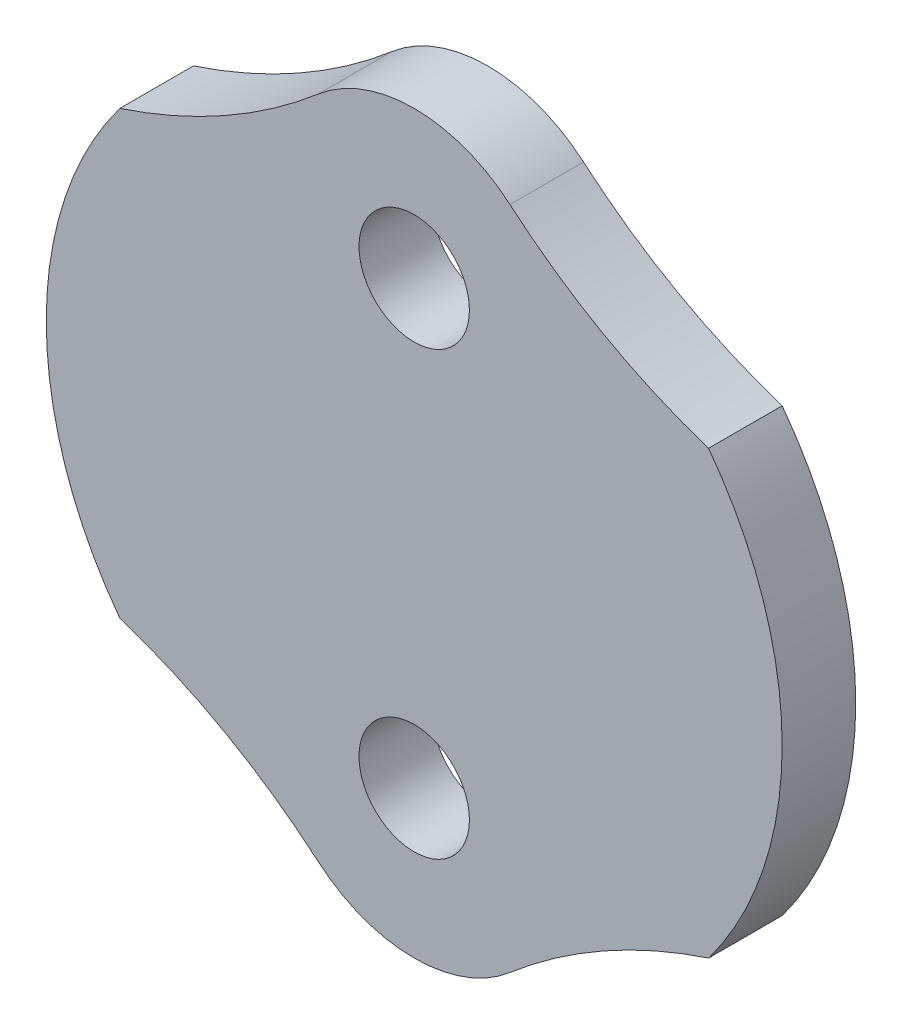
from build123d import *

# Parameters (mm, degrees)
SKETCH1_R           = 15.875
SKETCH1_R_2         = 2.38125
BOSS_EXTRUDE2_DEPTH = 3.175
SKETCH2_R           = 26.68586127
SKETCH2_R_2         = 15.875
CUT_EXTRUDE1_DEPTH  = 31.120694713


with BuildPart() as part:
    # Sketch1 → Boss-Extrude2 (new body)
    with BuildSketch(Plane.XY):
        with Locations((0, 9.525)):
            Circle(SKETCH1_R)
        Circle(SKETCH1_R_2, mode=Mode.SUBTRACT)
        with Locations((0, 19.05)):
            Circle(SKETCH1_R_2, mode=Mode.SUBTRACT)
    extrude(amount=BOSS_EXTRUDE2_DEPTH)

    # Sketch2 → Cut-Extrude1 (cut, through all)
    # profile 1 of 5: a face of its own
    with BuildSketch(Plane.XY.offset(3.175)):
        with Locations((0, 9.525)):
            Circle(SKETCH2_R)
        with Locations((0, 9.525)):
            Circle(SKETCH2_R_2, mode=Mode.SUBTRACT)
    # profile 2 of 5: a face of its own
    with BuildSketch(Plane.XY.offset(3.175)):
        with BuildLine():
            ThreePointArc((-4.130251428, 23.873227461), (-2.201704524, 25.006089085), (0, 25.4))
            ThreePointArc((0, 25.4), (-7.099515829, 23.724031657), (-12.7, 19.05))
            ThreePointArc((-12.7, 19.05), (-8.178609866, 21.041380315), (-4.130251428, 23.873227461))
        make_face()
    # profile 3 of 5: a face of its own
    with BuildSketch(Plane.XY.offset(3.175)):
        with BuildLine():
            ThreePointArc((4.130251428, 23.873227461), (8.178609866, 21.041380315), (12.7, 19.05))
            ThreePointArc((12.7, 19.05), (7.099515829, 23.724031657), (0, 25.4))
            ThreePointArc((0, 25.4), (2.201704524, 25.006089085), (4.130251428, 23.873227461))
        make_face()
    # profile 4 of 5: a face of its own
    with BuildSketch(Plane.XY.offset(3.175)):
        with BuildLine():
            ThreePointArc((-3e-09, -6.35), (7.099515827, -4.674031658), (12.7, 0))
            ThreePointArc((12.7, 0), (8.178609866, -1.991380315), (4.130251428, -4.823227461))
            ThreePointArc((4.130251428, -4.823227461), (2.201704523, -5.956089085), (-3e-09, -6.35))
        make_face()
    # profile 5 of 5: a face of its own
    with BuildSketch(Plane.XY.offset(3.175)):
        with BuildLine():
            ThreePointArc((-12.7, 0), (-7.09951583, -4.674031657), (-3e-09, -6.35))
            ThreePointArc((-3e-09, -6.35), (-2.201704525, -5.956089084), (-4.130251428, -4.823227461))
            ThreePointArc((-4.130251428, -4.823227461), (-8.178609866, -1.991380315), (-12.7, 0))
        make_face()
    extrude(amount=-CUT_EXTRUDE1_DEPTH, mode=Mode.SUBTRACT)


solid = part.part
